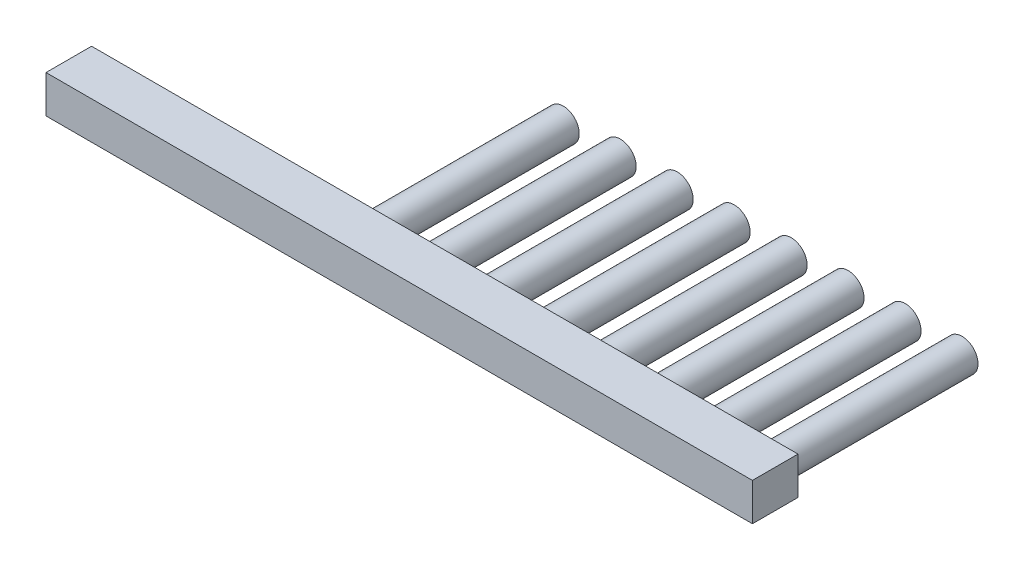
from build123d import *

# Parameters (mm, degrees)
SKETCH2_W           = 310
SKETCH2_H           = 16.5
BOSS_EXTRUDE1_DEPTH = 20
SKETCH3_R           = 7
BOSS_EXTRUDE2_DEPTH = 82
LPATTERN1_COUNT     = 8
LPATTERN1_PITCH     = 25


with BuildPart() as part:
    # Sketch2 → Boss-Extrude1 (new body)
    with BuildSketch(Plane.XY):
        Rectangle(SKETCH2_W, SKETCH2_H)
    extrude(amount=BOSS_EXTRUDE1_DEPTH)

    # Sketch3 → Boss-Extrude2 (add)
    with BuildSketch(Plane(origin=(0, 0, 0), x_dir=(-1, 0, 0), z_dir=(0, 0, -1))):
        with Locations((-145, 0)):
            Circle(SKETCH3_R)
    boss_extrude2 = extrude(amount=BOSS_EXTRUDE2_DEPTH)

    # LPattern1: Boss-Extrude2 ×8
    with Locations(*[(-i * LPATTERN1_PITCH, 0, 0) for i in range(1, LPATTERN1_COUNT)]):
        add(boss_extrude2)


solid = part.part
